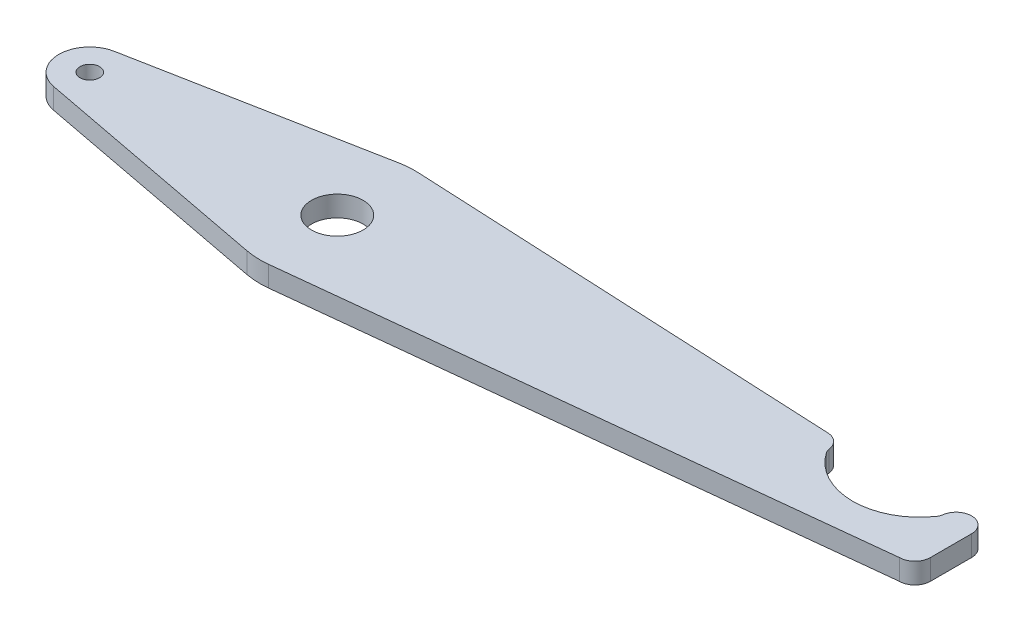
from build123d import *

# Parameters (mm, degrees)
SKETCH1_R           = 1.5
SKETCH1_R_2         = 3.96875
BOSS_EXTRUDE1_DEPTH = 1.5875
FILLET1_R           = 1.5875


with BuildPart() as part:
    # Sketch1 → Boss-Extrude1 (new, symmetric)
    # profile 1 of 3: a face of its own
    with BuildSketch(Plane(origin=(0, 0, 0), x_dir=(1, 0, 0), z_dir=(0, 1, 0))):
        with BuildLine():
            Line((-2.232421875, 11.695087928), (-38.99296875, 4.678035171))
            ThreePointArc((-38.99296875, 4.678035171), (-42.8625, 0), (-38.99296875, -4.678035171))
            Line((-38.99296875, -4.678035171), (-2.232421875, -11.695087928))
            ThreePointArc((-2.232421875, -11.695087928), (-0.48273715, -11.896459722), (1.277510766, -11.837514744))
            Line((1.277510766, -11.837514744), (88.9, -2.38125))
            ThreePointArc((88.9, -2.38125), (87.216201977, -1.683798023), (86.51875, 0))
            Line((86.51875, 0), (86.51875, 6.35))
            ThreePointArc((86.51875, 6.35), (77.7875, 1.528980536), (69.05625, 6.35))
            Line((69.05625, 6.35), (69.05625, 0))
            ThreePointArc((69.05625, 0), (66.675, -2.38125), (64.29375, 0))
            Line((64.29375, 0), (64.29375, 6.35))
            ThreePointArc((64.29375, 6.35), (64.991201977, 8.033798023), (66.675, 8.73125))
            Line((66.675, 8.73125), (0.568744164, 11.892658203))
            ThreePointArc((0.568744164, 11.892658203), (-0.837683941, 11.876745121), (-2.232421875, 11.695087928))
        make_face()
        with Locations(Location((-38.1, 0, 0), (0, 0, 270))):
            Circle(SKETCH1_R, mode=Mode.SUBTRACT)
        with Locations(Location((0, 0, 0), (0, 0, 270))):
            Circle(SKETCH1_R_2, mode=Mode.SUBTRACT)
    # profile 2 of 3: a face of its own
    with BuildSketch(Plane(origin=(0, 0, 0), x_dir=(1, 0, 0), z_dir=(0, 1, 0))):
        with BuildLine():
            ThreePointArc((69.05625, 6.35), (68.358798023, 8.033798023), (66.675, 8.73125))
            ThreePointArc((66.675, 8.73125), (64.991201977, 8.033798023), (64.29375, 6.35))
            Line((64.29375, 6.35), (64.29375, 0))
            ThreePointArc((64.29375, 0), (66.675, -2.38125), (69.05625, 0))
            Line((69.05625, 0), (69.05625, 6.35))
        make_face()
    # profile 3 of 3: a face of its own
    with BuildSketch(Plane(origin=(0, 0, 0), x_dir=(1, 0, 0), z_dir=(0, 1, 0))):
        with BuildLine():
            ThreePointArc((86.51875, 0), (87.216201977, -1.683798023), (88.9, -2.38125))
            ThreePointArc((88.9, -2.38125), (90.583798023, -1.683798023), (91.28125, 0))
            Line((91.28125, 0), (91.28125, 6.35))
            ThreePointArc((91.28125, 6.35), (88.9, 8.73125), (86.51875, 6.35))
            Line((86.51875, 6.35), (86.51875, 0))
        make_face()
    extrude(amount=BOSS_EXTRUDE1_DEPTH, both=True)

    # Fillet1
    fillet1_edges = [part.edges().sort_by_distance(p)[0] for p in [
        (69.05625, 0, -6.35),
        (86.51875, 0, -6.35),
    ]]
    fillet(fillet1_edges, radius=FILLET1_R)


solid = part.part
